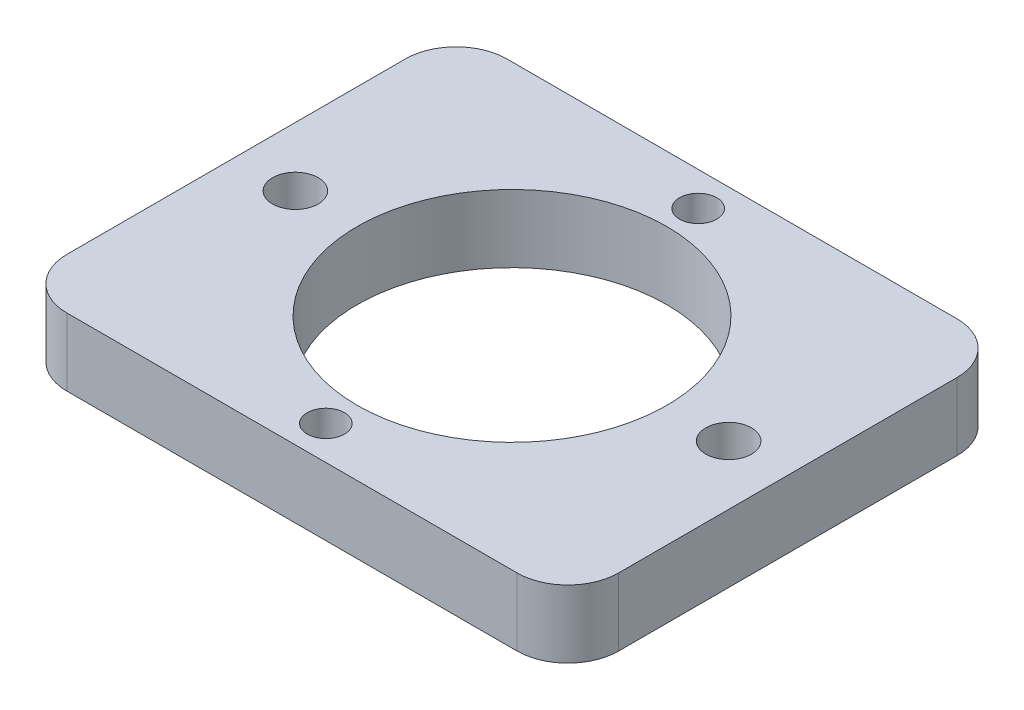
from build123d import *

# Parameters (mm, degrees)
SKETCH1_W           = 32.6
SKETCH1_H           = 26
BOSS_EXTRUDE1_DEPTH = 4
SKETCH2_R           = 9.15
SKETCH2_R_2         = 1.35
SKETCH2_R_3         = 1.1
CUT_EXTRUDE1_DEPTH  = 4
FILLET1_R           = 3


with BuildPart() as part:
    # Sketch1 → Boss-Extrude1 (new body)
    with BuildSketch(Plane(origin=(0, 0, 0), x_dir=(1, 0, 0), z_dir=(0, 1, 0))):
        with Locations((16.3, -13)):
            Rectangle(SKETCH1_W, SKETCH1_H)
    extrude(amount=BOSS_EXTRUDE1_DEPTH)

    # Sketch2 → Cut-Extrude1 (cut)
    with BuildSketch(Plane(origin=(0, 4, 0), x_dir=(1, 0, 0), z_dir=(0, 1, 0))):
        with Locations(Location((16.3, -13, 0), (0, 0, 270))):
            Circle(SKETCH2_R)
        with Locations(Location((3.5, -13, 0), (0, 0, 270))):
            Circle(SKETCH2_R_2)
        with Locations(Location((29.1, -13, 0), (0, 0, 270))):
            Circle(SKETCH2_R_2)
        with Locations(Location((16.3, -2, 0), (0, 0, 270))):
            Circle(SKETCH2_R_3)
        with Locations(Location((16.3, -24, 0), (0, 0, 270))):
            Circle(SKETCH2_R_3)
    extrude(amount=-CUT_EXTRUDE1_DEPTH, mode=Mode.SUBTRACT)

    # Fillet1
    fillet1_edges = [part.edges().sort_by_distance(p)[0] for p in [
        (0, 2, 0),
        (32.6, 2, 0),
        (32.6, 2, 26),
        (0, 2, 26),
    ]]
    fillet(fillet1_edges, radius=FILLET1_R)


solid = part.part
